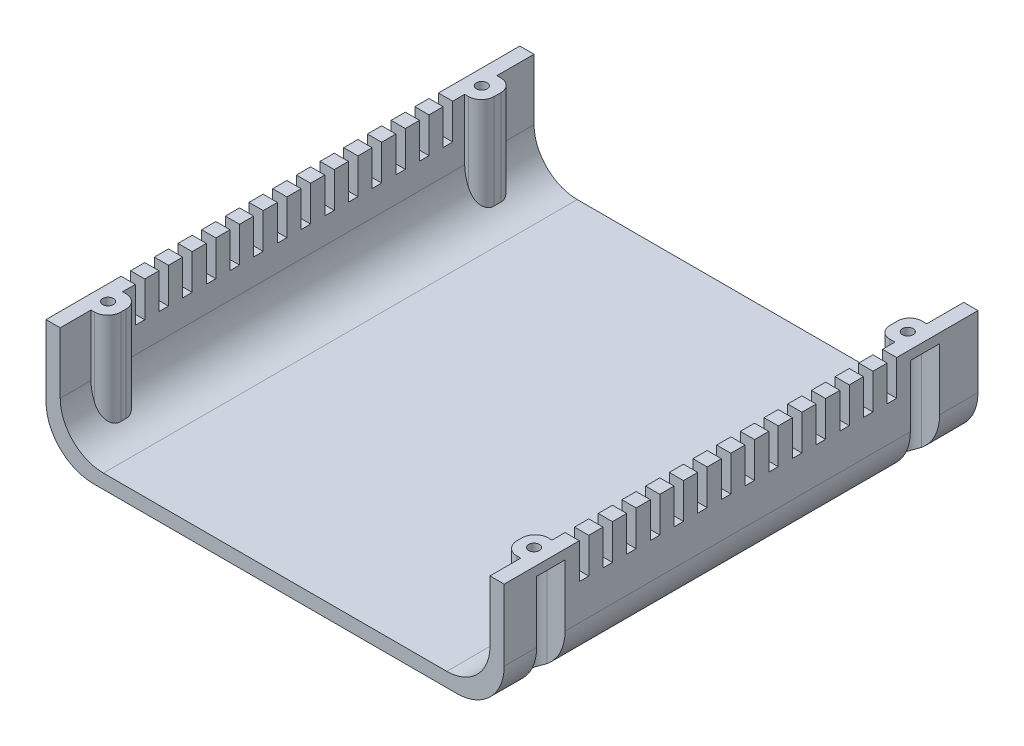
from build123d import *

# Parameters (mm, degrees)
BOSS_EXTRUDE1_DEPTH     = 100
BOSS_EXTRUDE2_DEPTH     = 20
CUT_EXTRUDE1_DEPTH      = 142.336088898
CUT_EXTRUDE1_DEPTH_BACK = 142.336088898
SKETCH15_W              = 2
SKETCH15_H              = 11.944817218
F_4_40_TAPPED_HOLE1_D   = 2.2606
CUT_EXTRUDE2_DEPTH      = 23


with BuildPart() as part:
    # Sketch1 → Boss-Extrude1 (new body)
    with BuildSketch(Plane.XY):
        with BuildLine():
            Line((10, 0), (86.7, 0))
            ThreePointArc((86.7, 0), (93.771067812, 2.928932188), (96.7, 10))
            Line((96.7, 10), (96.7, 25))
            Line((96.7, 25), (93.7, 25))
            Line((93.7, 25), (93.7, 12.121320344))
            ThreePointArc((93.7, 12.121320344), (91.028427125, 5.671572875), (84.578679656, 3))
            Line((84.578679656, 3), (12.121320344, 3))
            ThreePointArc((12.121320344, 3), (5.671572875, 5.671572875), (3, 12.121320344))
            Line((3, 12.121320344), (3, 25))
            Line((3, 25), (0, 25))
            Line((0, 25), (0, 10))
            ThreePointArc((0, 10), (2.928932188, 2.928932188), (10, 0))
        make_face()
    extrude(amount=BOSS_EXTRUDE1_DEPTH)

    # Sketch2 → Boss-Extrude2 (add)
    with BuildSketch(Plane(origin=(0, 25, 0), x_dir=(1, 0, 0), z_dir=(0, 1, 0))):
        with BuildLine():
            Line((3, -86.83850669), (3.720147204, -86.83850669))
            ThreePointArc((3.720147204, -86.83850669), (5.700046189, -87.658607701), (6.5201472, -89.638506686))
            Line((6.5201472, -89.638506686), (6.5201472, -90.708506694))
            ThreePointArc((6.5201472, -90.708506694), (5.700046189, -92.688405679), (3.720147204, -93.50850669))
            Line((3.720147204, -93.50850669), (3, -93.50850669))
            Line((3, -93.50850669), (3, -86.83850669))
        make_face()
        with BuildLine():
            Line((93.7, -86.90850669), (92.920147204, -86.90850669))
            ThreePointArc((92.920147204, -86.90850669), (90.940248214, -87.728607704), (90.1201472, -89.708506694))
            Line((90.1201472, -89.708506694), (90.1201472, -90.708506686))
            ThreePointArc((90.1201472, -90.708506686), (90.940248214, -92.688405676), (92.920147204, -93.50850669))
            Line((92.920147204, -93.50850669), (93.7, -93.50850669))
            Line((93.7, -93.50850669), (93.7, -86.90850669))
        make_face()
        with BuildLine():
            Line((93.7, -7.83697223), (92.6201472, -7.83697223))
            ThreePointArc((92.6201472, -7.83697223), (90.852380247, -8.569205277), (90.1201472, -10.33697223))
            Line((90.1201472, -10.33697223), (90.1201472, -12.03697223))
            ThreePointArc((90.1201472, -12.03697223), (90.852380247, -13.804739183), (92.6201472, -14.53697223))
            Line((92.6201472, -14.53697223), (93.7, -14.53697223))
            Line((93.7, -14.53697223), (93.7, -7.83697223))
        make_face()
        with BuildLine():
            Line((3, -7.83697223), (3.820147204, -7.83697223))
            ThreePointArc((3.820147204, -7.83697223), (5.72933551, -8.62778392), (6.5201472, -10.536972226))
            Line((6.5201472, -10.536972226), (6.5201472, -11.936972234))
            ThreePointArc((6.5201472, -11.936972234), (5.72933551, -13.84616054), (3.820147204, -14.63697223))
            Line((3.820147204, -14.63697223), (3, -14.63697223))
            Line((3, -14.63697223), (3, -7.83697223))
        make_face()
    extrude(amount=-BOSS_EXTRUDE2_DEPTH)

    # Sketch15 → Cut-Extrude1 (cut, two sides: drawn at the far end of the back side and taken through both)
    with BuildSketch(Plane(origin=(96.7, 0, 0), x_dir=(0, 0, -1), z_dir=(1, 0, 0)).offset(-CUT_EXTRUDE1_DEPTH_BACK)):
        with Locations((-78.151538462, 23.514583327)):
            Rectangle(SKETCH15_W, SKETCH15_H)
        with Locations((-83.15, 23.514583327)):
            Rectangle(SKETCH15_W, SKETCH15_H)
        with Locations((-73.153076923, 23.514583327)):
            Rectangle(SKETCH15_W, SKETCH15_H)
        with Locations((-68.154615385, 23.514583327)):
            Rectangle(SKETCH15_W, SKETCH15_H)
        with Locations((-63.156153846, 23.514583327)):
            Rectangle(SKETCH15_W, SKETCH15_H)
        with Locations((-58.157692308, 23.514583327)):
            Rectangle(SKETCH15_W, SKETCH15_H)
        with Locations((-53.159230769, 23.514583327)):
            Rectangle(SKETCH15_W, SKETCH15_H)
        with Locations((-48.160769231, 23.514583327)):
            Rectangle(SKETCH15_W, SKETCH15_H)
        with Locations((-43.162307692, 23.514583327)):
            Rectangle(SKETCH15_W, SKETCH15_H)
        with Locations((-38.163846154, 23.514583327)):
            Rectangle(SKETCH15_W, SKETCH15_H)
        with Locations((-33.165384615, 23.514583327)):
            Rectangle(SKETCH15_W, SKETCH15_H)
        with Locations((-28.166923077, 23.514583327)):
            Rectangle(SKETCH15_W, SKETCH15_H)
        with Locations((-23.168461538, 23.514583327)):
            Rectangle(SKETCH15_W, SKETCH15_H)
        with Locations((-18.17, 23.514583327)):
            Rectangle(SKETCH15_W, SKETCH15_H)
    extrude(amount=CUT_EXTRUDE1_DEPTH + CUT_EXTRUDE1_DEPTH_BACK, mode=Mode.SUBTRACT)

    # #4-40 Tapped Hole1 (through all)
    with Locations(Plane(origin=(3.25, 25, 11.27918238), x_dir=(0, 0, 1), z_dir=(0, 1, 0))):
        with Locations((0, 0), (78.87081762, 0), (78.87081762, 89.91), (0, 89.91)):
            Hole(F_4_40_TAPPED_HOLE1_D / 2)

    # Sketch19 → Cut-Extrude2 (cut)
    with BuildSketch(Plane.XZ):
        with BuildLine():
            Line((0, 14.27918238), (3.72, 14.27918238))
            ThreePointArc((3.72, 14.27918238), (5.487766953, 13.546949333), (6.22, 11.77918238))
            Line((6.22, 11.77918238), (6.22, 10.77918238))
            ThreePointArc((6.22, 10.77918238), (5.487766953, 9.011415427), (3.72, 8.27918238))
            Line((3.72, 8.27918238), (0, 8.27918238))
            Line((0, 8.27918238), (0, 14.27918238))
        make_face()
        with BuildLine():
            Line((0, 93.15), (3.72, 93.15))
            ThreePointArc((3.72, 93.15), (5.487766953, 92.417766953), (6.22, 90.65))
            Line((6.22, 90.65), (6.22, 89.65))
            ThreePointArc((6.22, 89.65), (5.487766953, 87.882233047), (3.72, 87.15))
            Line((3.72, 87.15), (0, 87.15))
            Line((0, 87.15), (0, 93.15))
        make_face()
        with BuildLine():
            Line((96.7, 93.15), (92.92, 93.15))
            ThreePointArc((92.92, 93.15), (91.152233047, 92.417766953), (90.42, 90.65))
            Line((90.42, 90.65), (90.42, 89.65))
            ThreePointArc((90.42, 89.65), (91.152233047, 87.882233047), (92.92, 87.15))
            Line((92.92, 87.15), (96.7, 87.15))
            Line((96.7, 87.15), (96.7, 93.15))
        make_face()
        with BuildLine():
            Line((96.7, 14.27918238), (92.92, 14.27918238))
            ThreePointArc((92.92, 14.27918238), (91.152233047, 13.546949333), (90.42, 11.77918238))
            Line((90.42, 11.77918238), (90.42, 10.600852744))
            ThreePointArc((90.42, 10.600852744), (91.152233047, 8.833085791), (92.92, 8.100852744))
            Line((92.92, 8.100852744), (96.7, 8.100852744))
            Line((96.7, 8.100852744), (96.7, 14.27918238))
        make_face()
    extrude(amount=-CUT_EXTRUDE2_DEPTH, mode=Mode.SUBTRACT)


solid = part.part
